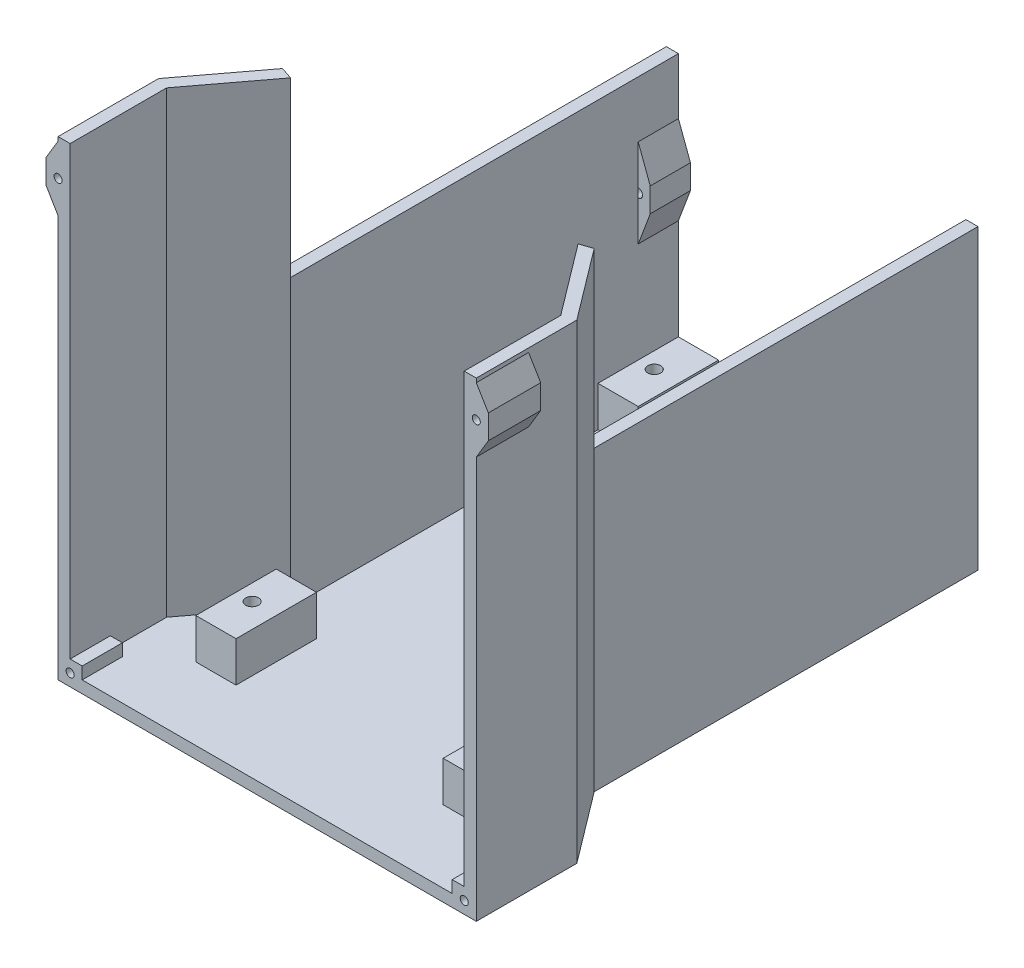
from build123d import *

# Parameters (mm, degrees)
DODANIE_WYCI_GNI_CIE1_DEPTH   = 3
DODANIE_WYCI_GNI_CIE2_DEPTH   = 71
DODANIE_WYCI_GNI_CIE4_DEPTH   = 43
DODANIE_WYCI_GNI_CIE5_DEPTH   = 10
DODANIE_WYCI_GNI_CIE6_DEPTH   = 10
DODANIE_WYCI_GNI_CIE6_2_DEPTH = 10
DODANIE_WYCI_GNI_CIE7_DEPTH   = 10
SZKIC4_5_R                    = 0.9999999999999987
WYTNIJ_WYCI_GNI_CIE1_DEPTH    = 10
SZKIC3_3_R                    = 1.100000000000006
SZKIC3_3_R_2                  = 1.100000000000001
WYTNIJ_WYCI_GNI_CIE2_DEPTH    = 10
DODANIE_WYCI_GNI_CIE11_DEPTH  = 3
SZKIC12_R                     = 1.6000000000000019
SZKIC12_R_2                   = 1.600000000000005
SZKIC12_R_3                   = 1.5999999999999988
SZKIC12_R_4                   = 1.600000000000002
WYTNIJ_WYCI_GNI_CIE3_DEPTH    = 13
SFAZOWANIE2_SIZE              = 1


with BuildPart() as part:
    # Szkic1 → Dodanie-wyciągnięcie1 (new body)
    # profile 1 of 9: a face of its own
    with BuildSketch(Plane(origin=(0, 0, 0), x_dir=(1, 0, 0), z_dir=(0, 1, 0))):
        Polygon((16.250000000000007, 138), (16.25000000000002, 41.557646628857135), (3.0000000000000027, 23.99525783917362), (3.0000000000000027, 0), (0, 0), (0, 25), (13.25, 42.56238878968349), (13.249999999999977, 138), align=None)
    # profile 2 of 9: a face of its own
    with BuildSketch(Plane(origin=(0, 0, 0), x_dir=(1, 0, 0), z_dir=(0, 1, 0))):
        Polygon((16.250000000000007, 138), (16.25000000000001, 118.00000000000001), (22.250000000000018, 118.00000000000001), (26.250000000000014, 118.00000000000001), (26.25000000000001, 138), align=None)
    # profile 3 of 9: a face of its own
    with BuildSketch(Plane(origin=(0, 0, 0), x_dir=(1, 0, 0), z_dir=(0, 1, 0))):
        Polygon((16.25000000000001, 118.00000000000001), (16.25000000000002, 41.55764662885713), (16.25000000000002, 38.00000000000002), (22.250000000000018, 38.00000000000002), (22.250000000000018, 118.00000000000003), align=None)
    # profile 4 of 9: a face of its own
    with BuildSketch(Plane(origin=(0, 0, 0), x_dir=(1, 0, 0), z_dir=(0, 1, 0))):
        Polygon((3.0000000000000027, 23.99525783917362), (3.0000000000000027, 0), (100.99999999999996, 2.329e-14), (100.99999999999997, 23.99525783917362), (87.74999999999994, 41.557646628857135), (87.74999999999994, 38.00000000000002), (87.74999999999991, 18.000000000000014), (77.74999999999991, 18.00000000000002), (77.74999999999991, 38.00000000000003), (81.74999999999991, 38.00000000000002), (81.7499999999999, 118.00000000000003), (77.74999999999991, 118.00000000000001), (77.74999999999991, 138), (26.25000000000001, 138), (26.250000000000014, 118.00000000000001), (22.250000000000018, 118.00000000000001), (22.250000000000018, 38.00000000000002), (26.250000000000025, 38.00000000000002), (26.250000000000025, 18.000000000000014), (16.25000000000002, 18.000000000000014), (16.25000000000002, 38.00000000000002), (16.25000000000002, 41.557646628857135), align=None)
        Polygon((48, 112.00000000000001), (55.99999999999997, 112), (55.999999999999964, 104.00000000000001), (48, 104.00000000000001), align=None, mode=Mode.SUBTRACT)
    # profile 5 of 9: a face of its own
    with BuildSketch(Plane(origin=(0, 0, 0), x_dir=(1, 0, 0), z_dir=(0, 1, 0))):
        Polygon((81.7499999999999, 118.00000000000001), (87.74999999999991, 118.00000000000003), (87.74999999999994, 138), (77.74999999999991, 138), (77.74999999999991, 118.00000000000001), align=None)
    # profile 6 of 9: a face of its own
    with BuildSketch(Plane(origin=(0, 0, 0), x_dir=(1, 0, 0), z_dir=(0, 1, 0))):
        Polygon((87.74999999999994, 38.00000000000002), (87.74999999999994, 41.557646628857135), (87.74999999999994, 118.00000000000003), (81.7499999999999, 118.00000000000001), (81.74999999999991, 38.00000000000003), align=None)
    # profile 7 of 9: a face of its own
    with BuildSketch(Plane(origin=(0, 0, 0), x_dir=(1, 0, 0), z_dir=(0, 1, 0))):
        Polygon((87.74999999999994, 138), (90.74999999999996, 137.9999999999999), (90.74999999999997, 42.56238878968349), (103.99999999999996, 25), (103.99999999999999, 2.4e-14), (100.99999999999996, 0), (100.99999999999997, 23.99525783917362), (87.74999999999994, 41.557646628857135), align=None)
    # profile 8 of 9: a face of its own
    with BuildSketch(Plane(origin=(0, 0, 0), x_dir=(1, 0, 0), z_dir=(0, 1, 0))):
        Polygon((22.250000000000018, 38.00000000000002), (16.250000000000018, 38.00000000000002), (16.25000000000002, 18.000000000000014), (26.250000000000025, 18.000000000000014), (26.250000000000025, 38.00000000000002), align=None)
    # profile 9 of 9: a face of its own
    with BuildSketch(Plane(origin=(0, 0, 0), x_dir=(1, 0, 0), z_dir=(0, 1, 0))):
        Polygon((87.74999999999991, 18.000000000000014), (87.74999999999994, 38.00000000000002), (81.74999999999991, 38.00000000000002), (77.74999999999991, 38.00000000000003), (77.74999999999991, 18.00000000000002), align=None)
    extrude(amount=-DODANIE_WYCI_GNI_CIE1_DEPTH)

    # Szkic1<3> → Dodanie-wyciągnięcie2 (add)
    with BuildSketch(Plane(origin=(0, 0, 0), x_dir=(1, 0, 0), z_dir=(0, 1, 0))):
        Polygon((0, 0), (3.0000000000000027, 0), (3.0000000000000027, 23.99525783917362), (16.25000000000002, 41.557646628857135), (16.250000000000007, 138), (13.249999999999977, 138), (13.25, 42.562388789683496), (0, 25), align=None)
        Polygon((100.99999999999997, 23.99525783917362), (100.99999999999996, 0), (103.99999999999999, 2.4e-14), (103.99999999999996, 25), (90.74999999999997, 42.56238878968349), (90.74999999999996, 137.9999999999999), (87.74999999999994, 138), (87.74999999999994, 41.55764662885713), align=None)
    extrude(amount=DODANIE_WYCI_GNI_CIE2_DEPTH)

    # Szkic2 → Dodanie-wyciągnięcie4 (add)
    with BuildSketch(Plane(origin=(0, 71, 0), x_dir=(1, 0, 0), z_dir=(0, 1, 0))):
        Polygon((90.74999999999997, 42.56238878968349), (87.74999999999994, 41.557646628857135), (100.99999999999996, 23.995257839173625), (100.99999999999996, 0), (103.99999999999999, 2.4e-14), (103.99999999999997, 25), align=None)
        Polygon((16.25000000000002, 41.557646628857135), (13.25, 42.56238878968349), (-5.33e-15, 25), (0, 0), (3.0000000000000027, 0), (3.0000000000000027, 23.99525783917362), align=None)
    extrude(amount=DODANIE_WYCI_GNI_CIE4_DEPTH)

    # Szkic1<5> → Dodanie-wyciągnięcie5 (add)
    with BuildSketch(Plane(origin=(0, 0, 0), x_dir=(1, 0, 0), z_dir=(0, 1, 0))):
        Polygon((22.250000000000018, 38.00000000000002), (16.250000000000018, 38.00000000000002), (16.25000000000002, 18.000000000000014), (26.250000000000025, 18.000000000000014), (26.250000000000025, 38.00000000000002), align=None)
        Polygon((87.74999999999991, 18.000000000000014), (87.74999999999994, 38.00000000000002), (81.74999999999991, 38.00000000000002), (77.74999999999991, 38.00000000000003), (77.74999999999991, 18.00000000000002), align=None)
        Polygon((16.250000000000007, 138), (16.25000000000001, 118.00000000000001), (22.250000000000018, 118.00000000000001), (26.250000000000014, 118.00000000000001), (26.25000000000001, 138), align=None)
        Polygon((81.7499999999999, 118.00000000000001), (87.74999999999991, 118.00000000000003), (87.74999999999994, 138), (77.74999999999991, 138), (77.74999999999991, 118.00000000000001), align=None)
    extrude(amount=DODANIE_WYCI_GNI_CIE5_DEPTH)

    # Szkic4 → Dodanie-wyciągnięcie7 (add)
    with BuildSketch(Plane.XY):
        Polygon((0, 113.01054887212972), (-3.0000000000000027, 108.00000000000004), (-3.0000000000000027, 102.00000000000001), (0, 96.98945112787034), align=None)
        Polygon((5.999999999999927, 2.9999999999999756), (3.0000000000000027, 2.9999999999999813), (3.0000000000000027, 0), (5.999999999999928, 0), align=None)
        Polygon((97.99999999999994, 2.9999999999999756), (97.99999999999994, 0), (100.99999999999996, 0), (100.99999999999996, 2.9999999999999836), align=None)
        with BuildLine():
            Line((103.99999999999989, 96.98945112787034), (106.99999999999987, 102.00000000000001))
            Line((106.99999999999987, 102.00000000000001), (106.99999999999987, 108.00000000000004))
            Line((106.99999999999987, 108.00000000000004), (103.99999999999989, 113.01054887212972))
            Line((103.99999999999989, 113.01054887212972), (103.99999999999996, 106.00000000000004))
            ThreePointArc((103.99999999999996, 106.00000000000004), (104.99999999999986, 105.00000000000004), (103.99999999999996, 104.00000000000004))
            Line((103.99999999999996, 104.00000000000004), (103.99999999999989, 96.98945112787034))
        make_face()
    extrude(amount=-DODANIE_WYCI_GNI_CIE7_DEPTH)

    # Szkic4<5> → Wytnij-wyciągnięcie1 (cut)
    with BuildSketch(Plane.XY):
        with BuildLine():
            Line((3.0000000000000027, 0), (3.0000000000000027, 0.9999999999999849))
            ThreePointArc((3.00000000000002, 0.9999999999999849), (2.2928932188133495, -0.7071067811865266), (3.999999999999926, -1.326e-14))
            Line((3.999999999999929, 0), (3, 0))
        make_face()
        with BuildLine():
            ThreePointArc((3.999999999999926, -1.301e-14), (3.7071067811865066, 0.7071067811865006), (3.00000000000002, 0.9999999999999849))
            Line((3.0000000000000027, 0.9999999999999849), (3.0000000000000027, 0))
            Line((3, 0), (3.999999999999929, 0))
        make_face()
        with BuildLine():
            Line((3.0000000000000027, 0), (3.0000000000000027, 0.9999999999999849))
            ThreePointArc((3.00000000000002, 0.9999999999999849), (2.2928932188133495, -0.7071067811865266), (3.999999999999926, -1.326e-14))
            Line((3.999999999999929, 0), (3, 0))
        make_face()
        with BuildLine():
            ThreePointArc((3.999999999999926, -1.301e-14), (3.7071067811865066, 0.7071067811865006), (3.00000000000002, 0.9999999999999849))
            Line((3.0000000000000027, 0.9999999999999849), (3.0000000000000027, 0))
            Line((3, 0), (3.999999999999929, 0))
        make_face()
        with BuildLine():
            Line((100.99999999999996, 0), (99.99999999999997, 0))
            ThreePointArc((99.99999999999997, -1.289e-14), (100.99999999999997, -1.0000000000000113), (101.99999999999997, -1.326e-14))
            ThreePointArc((101.99999999999997, -1.301e-14), (101.70710678118652, 0.7071067811865333), (100.99999999999997, 0.9999999999999853))
            Line((100.99999999999996, 0.9999999999999858), (100.99999999999996, 0))
        make_face()
        with BuildLine():
            ThreePointArc((100.99999999999997, 0.9999999999999853), (100.29289321881342, 0.7071067811865334), (99.99999999999997, -1.289e-14))
            Line((99.99999999999997, 0), (100.99999999999996, 0))
            Line((100.99999999999996, 0), (100.99999999999996, 0.9999999999999858))
        make_face()
        with BuildLine():
            Line((100.99999999999996, 0), (99.99999999999997, 0))
            ThreePointArc((99.99999999999997, -1.289e-14), (100.99999999999997, -1.0000000000000113), (101.99999999999997, -1.326e-14))
            ThreePointArc((101.99999999999997, -1.301e-14), (101.70710678118652, 0.7071067811865333), (100.99999999999997, 0.9999999999999853))
            Line((100.99999999999996, 0.9999999999999858), (100.99999999999996, 0))
        make_face()
        with BuildLine():
            ThreePointArc((100.99999999999997, 0.9999999999999853), (100.29289321881342, 0.7071067811865334), (99.99999999999997, -1.289e-14))
            Line((99.99999999999997, 0), (100.99999999999996, 0))
            Line((100.99999999999996, 0), (100.99999999999996, 0.9999999999999858))
        make_face()
        with BuildLine():
            Line((103.99999999999999, 106.00000000000004), (103.99999999999999, 104.00000000000004))
            ThreePointArc((103.99999999999996, 104.00000000000004), (104.70710678118644, 104.29289321881353), (104.99999999999986, 105.00000000000004))
            ThreePointArc((104.99999999999986, 105.00000000000004), (104.70710678118644, 105.70710678118655), (103.99999999999996, 106.00000000000004))
        make_face()
        with BuildLine():
            ThreePointArc((103.99999999999996, 106.00000000000004), (102.99999999999986, 105.00000000000004), (103.99999999999996, 104.00000000000004))
            Line((103.99999999999999, 104.00000000000004), (103.99999999999999, 106.00000000000004))
        make_face()
        with Locations((0, 105.00000000000003)):
            Circle(SZKIC4_5_R)
    extrude(amount=-WYTNIJ_WYCI_GNI_CIE1_DEPTH, mode=Mode.SUBTRACT)


with BuildPart() as body_2:
    # Szkic3 → Dodanie-wyciągnięcie6 (new body)
    with BuildSketch(Plane(origin=(0, 0, -138), x_dir=(-1, 0, 0), z_dir=(0, 0, -1))):
        Polygon((-87.74999999999997, 56.41619848709567), (-87.74999999999996, 35.583801512904344), (-84.74999999999996, 43), (-84.74999999999996, 49.00000000000001), align=None)
    extrude(amount=-DODANIE_WYCI_GNI_CIE6_DEPTH)


with BuildPart() as body_3:
    # Szkic3 → Dodanie-wyci_gni_cie6 2 (new body)
    with BuildSketch(Plane(origin=(0, 0, -138), x_dir=(-1, 0, 0), z_dir=(0, 0, -1))):
        Polygon((-16.250000000000004, 35), (-16.250000000000007, 57.000000000000014), (-19.24999999999999, 49.00000000000001), (-19.250000000000004, 43), align=None)
    extrude(amount=-DODANIE_WYCI_GNI_CIE6_2_DEPTH)


with BuildPart() as wytnij_wyci_gni_cie2_tool:
    # Szkic3<3> → Wytnij-wyciągnięcie2 (new body)
    with BuildSketch(Plane(origin=(0, 0, -138), x_dir=(-1, 0, 0), z_dir=(0, 0, -1))):
        with BuildLine():
            Line((-87.74999999999994, 44.9), (-87.74999999999994, 47.100000000000016))
            ThreePointArc((-87.74999999999997, 47.100000000000016), (-88.84999999999997, 46.00000000000001), (-87.74999999999997, 44.9))
        make_face()
        with BuildLine():
            ThreePointArc((-86.64999999999995, 46.00000000000001), (-86.97218254069476, 46.77781745930522), (-87.74999999999997, 47.100000000000016))
            Line((-87.74999999999994, 47.100000000000016), (-87.74999999999994, 44.9))
            ThreePointArc((-87.74999999999997, 44.9), (-86.97218254069476, 45.222182540694796), (-86.64999999999995, 46.00000000000001))
        make_face()
        with BuildLine():
            Line((-87.74999999999994, 44.9), (-87.74999999999994, 47.100000000000016))
            ThreePointArc((-87.74999999999997, 47.100000000000016), (-88.84999999999997, 46.00000000000001), (-87.74999999999997, 44.9))
        make_face()
        with BuildLine():
            ThreePointArc((-86.64999999999995, 46.00000000000001), (-86.97218254069476, 46.77781745930522), (-87.74999999999997, 47.100000000000016))
            Line((-87.74999999999994, 47.100000000000016), (-87.74999999999994, 44.9))
            ThreePointArc((-87.74999999999997, 44.9), (-86.97218254069476, 45.222182540694796), (-86.64999999999995, 46.00000000000001))
        make_face()
        with BuildLine():
            Line((-16.250000000000007, 44.900000000000006), (-16.250000000000007, 47.10000000000001))
            ThreePointArc((-16.250000000000032, 47.10000000000001), (-17.35, 46.00000000000001), (-16.25000000000003, 44.900000000000006))
        make_face()
        with BuildLine():
            ThreePointArc((-15.15, 46.00000000000001), (-15.47218254069481, 46.77781745930522), (-16.250000000000032, 47.10000000000001))
            Line((-16.250000000000007, 47.10000000000001), (-16.250000000000007, 44.900000000000006))
            ThreePointArc((-16.25000000000003, 44.900000000000006), (-15.472182540694808, 45.222182540694796), (-15.15, 46.00000000000001))
        make_face()
        with BuildLine():
            Line((-16.250000000000007, 44.900000000000006), (-16.250000000000007, 47.10000000000001))
            ThreePointArc((-16.250000000000032, 47.10000000000001), (-17.35, 46.00000000000001), (-16.25000000000003, 44.900000000000006))
        make_face()
        with BuildLine():
            ThreePointArc((-15.15, 46.00000000000001), (-15.47218254069481, 46.77781745930522), (-16.250000000000032, 47.10000000000001))
            Line((-16.250000000000007, 47.10000000000001), (-16.250000000000007, 44.900000000000006))
            ThreePointArc((-16.25000000000003, 44.900000000000006), (-15.472182540694808, 45.222182540694796), (-15.15, 46.00000000000001))
        make_face()
        with Locations((-87.74999999999997, 0)):
            Circle(SZKIC3_3_R)
        with Locations((-16.249999999999986, 0)):
            Circle(SZKIC3_3_R_2)
    extrude(amount=-WYTNIJ_WYCI_GNI_CIE2_DEPTH)


with BuildPart() as part_1:
    add(part.part)

    # Wytnij-wyciągnięcie2: cut by wytnij_wyci_gni_cie2_tool
    add(wytnij_wyci_gni_cie2_tool.part, mode=Mode.SUBTRACT)

    # Szkic11 → Dodanie-wyciągnięcie11 (add)
    with BuildSketch(Plane(origin=(0, 0, -10), x_dir=(-1, 0, 0), z_dir=(0, 0, -1))):
        Polygon((0, 113.01054887212972), (0, 106.00000000000003), (0, 104.00000000000003), (0, 96.98945112787035), (3.0000000000000027, 102.00000000000001), (3.0000000000000027, 108.00000000000004), align=None)
        Polygon((-103.99999999999999, 106.00000000000004), (-103.99999999999999, 113.01054887212958), (-106.99999999999987, 108.00000000000004), (-106.99999999999987, 102.00000000000001), (-103.99999999999999, 96.98945112787047), (-103.99999999999999, 104.00000000000004), align=None)
    extrude(amount=DODANIE_WYCI_GNI_CIE11_DEPTH)

    # Szkic12 → Wytnij-wyciągnięcie3 (cut)
    with BuildSketch(Plane(origin=(0, 10, 0), x_dir=(1, 0, 0), z_dir=(0, 1, 0))):
        with Locations(Location((20.25000000000002, 28.000000000000025, 0), (0, 0, 270))):
            Circle(SZKIC12_R)
        with Locations(Location((83.74999999999993, 28.00000000000004, 0), (0, 0, 270))):
            Circle(SZKIC12_R_2)
        with Locations(Location((20.250000000000007, 128, 0), (0, 0, 270))):
            Circle(SZKIC12_R_3)
        with Locations(Location((83.74999999999991, 128, 0), (0, 0, 270))):
            Circle(SZKIC12_R_4)
    extrude(amount=-WYTNIJ_WYCI_GNI_CIE3_DEPTH, mode=Mode.SUBTRACT)

    # Sfazowanie2
    sfazowanie2_edges = [part_1.edges().sort_by_distance(p)[0] for p in [
        (83.74999999999993, -3, -29.600000000000044),
        (20.250000000000007, -3, -129.6),
        (83.74999999999991, -3, -129.6),
        (20.25000000000002, -3, -29.600000000000026),
    ]]
    chamfer(sfazowanie2_edges, length=SFAZOWANIE2_SIZE)


with BuildPart() as body_2_1:
    add(body_2.part)

    # Wytnij-wyciągnięcie2: cut by wytnij_wyci_gni_cie2_tool
    add(wytnij_wyci_gni_cie2_tool.part, mode=Mode.SUBTRACT)


with BuildPart() as body_3_1:
    add(body_3.part)

    # Wytnij-wyciągnięcie2: cut by wytnij_wyci_gni_cie2_tool
    add(wytnij_wyci_gni_cie2_tool.part, mode=Mode.SUBTRACT)


solid = Compound([part_1.part, body_2_1.part, body_3_1.part])
